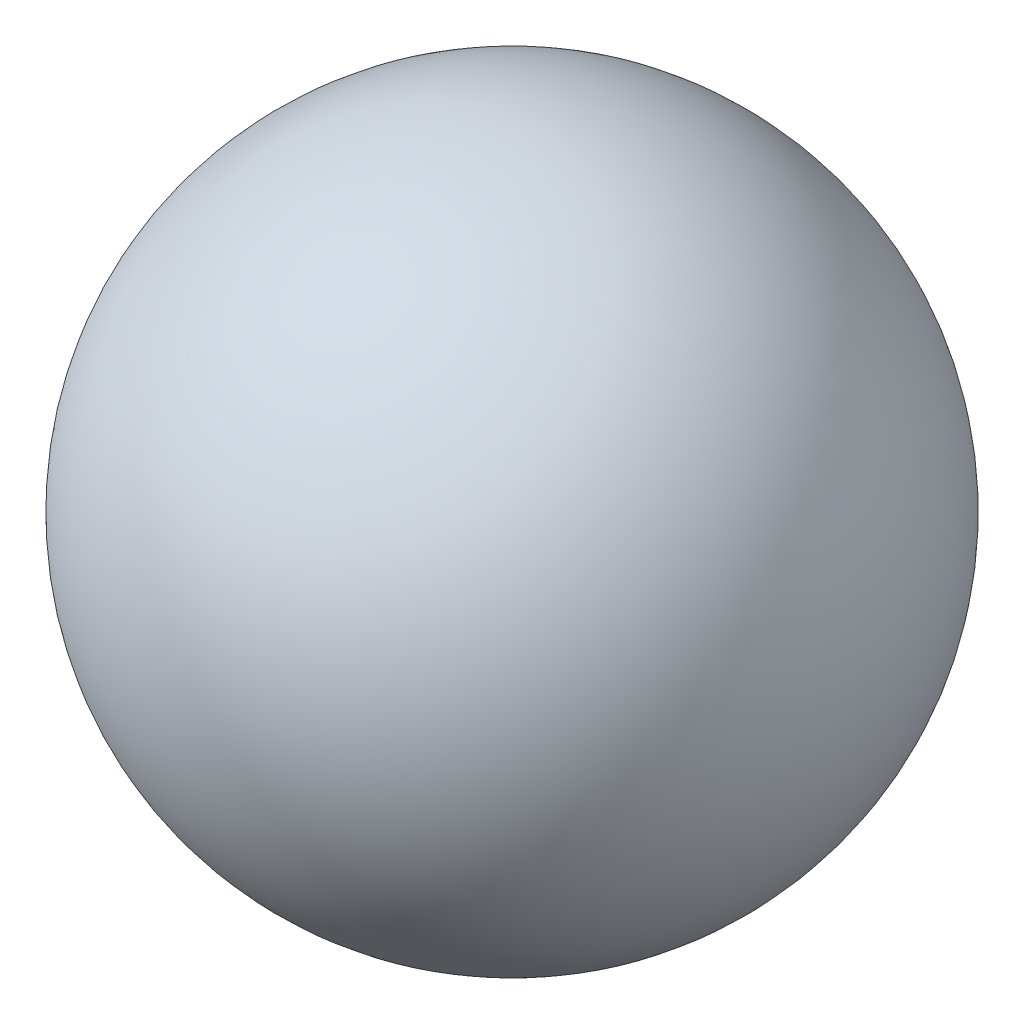
from build123d import *


with BuildPart() as part:
    # Sketch1 → Revolve1 (revolve)
    with BuildSketch(Plane.XY):
        with BuildLine():
            Line((0, 36.5), (0, -36.5))
            ThreePointArc((0, -36.5), (36.5, 0), (0, 36.5))
        make_face()
    revolve(axis=Axis((0, 36.5, 0), (0, -1, 0)))


solid = part.part
